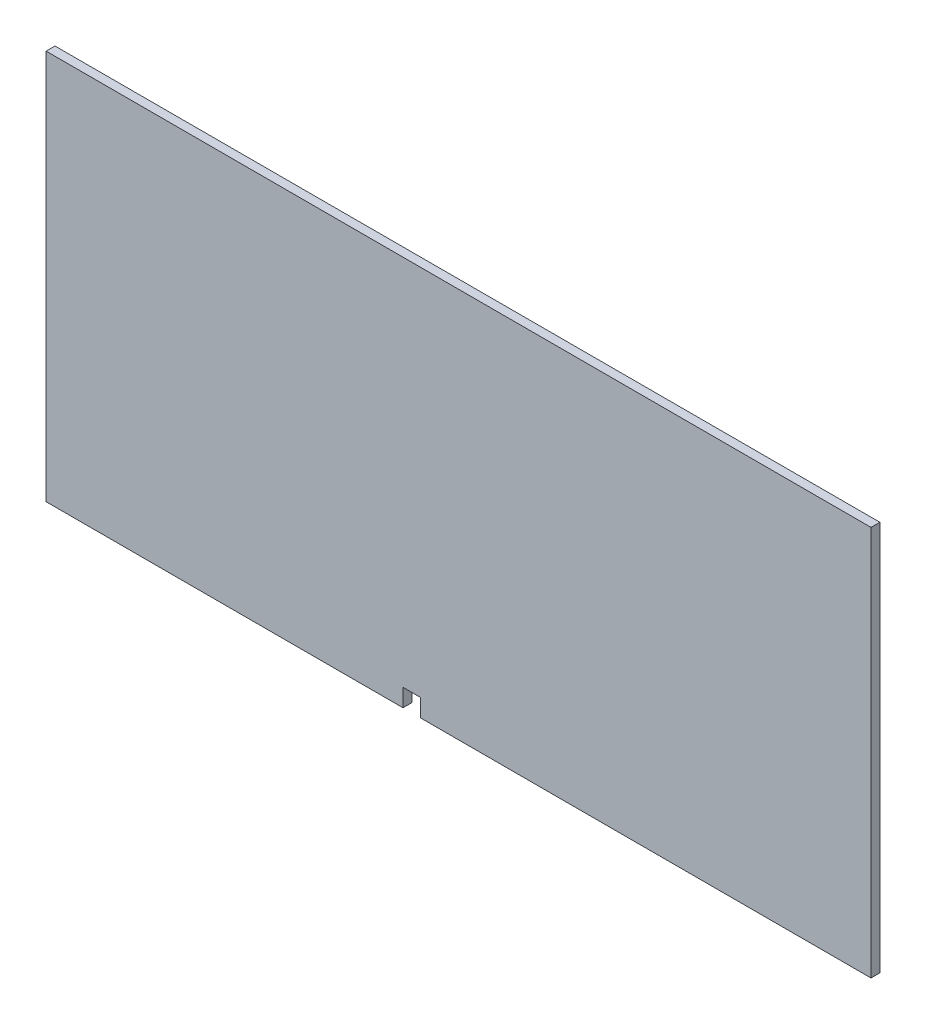
from build123d import *

# Parameters (mm, degrees)
SKETCH1_W           = 465
SKETCH1_H           = 220
BOSS_EXTRUDE1_DEPTH = 5
SKETCH2_W           = 10
SKETCH2_H           = 10
CUT_EXTRUDE1_DEPTH  = 10


with BuildPart() as part:
    # Sketch1 → Boss-Extrude1 (new body)
    with BuildSketch(Plane.XY):
        Rectangle(SKETCH1_W, SKETCH1_H)
    extrude(amount=BOSS_EXTRUDE1_DEPTH)

    # Sketch2 → Cut-Extrude1 (cut)
    with BuildSketch(Plane.XY.offset(5)):
        with Locations((-26.326952301, -105)):
            Rectangle(SKETCH2_W, SKETCH2_H)
    extrude(amount=-CUT_EXTRUDE1_DEPTH, mode=Mode.SUBTRACT)


solid = part.part
